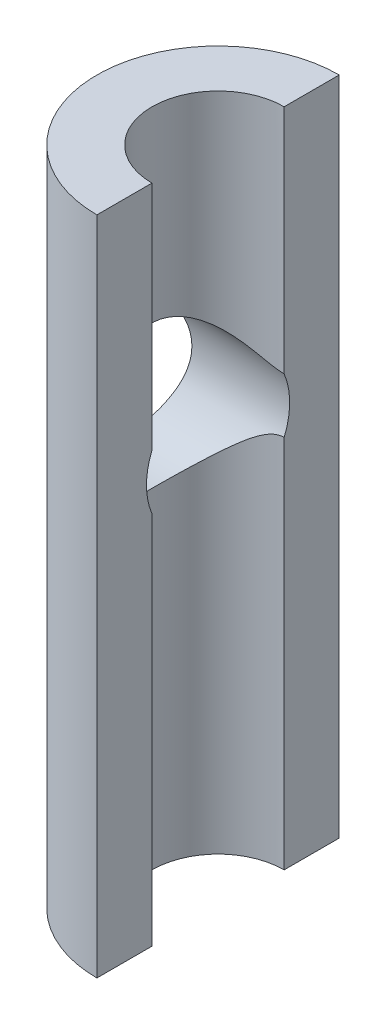
from build123d import *

# Parameters (mm, degrees)
BOSS_EXTRUDE1_DEPTH     = 30
CUT_EXTRUDE1_DEPTH      = 31.991934435
CUT_EXTRUDE1_DEPTH_BACK = 31.991934435
SKETCH2_R               = 3.25


with BuildPart() as part:
    # Sketch1 → Boss-Extrude1 (new body)
    with BuildSketch(Plane(origin=(0, 0, 0), x_dir=(1, 0, 0), z_dir=(0, 1, 0))):
        with BuildLine():
            Line((0, 5.5), (0, 3))
            ThreePointArc((0, 3), (-3, 0), (0, -3))
            Line((0, -3), (0, -5.5))
            ThreePointArc((0, -5.5), (-5.5, 0), (0, 5.5))
        make_face()
    extrude(amount=BOSS_EXTRUDE1_DEPTH)

    # Sketch2 → Cut-Extrude1 (cut, two sides: drawn at the far end of the back side and taken through both)
    with BuildSketch(Plane(origin=(0, 0, 0), x_dir=(0, 0, -1), z_dir=(1, 0, 0)).offset(-CUT_EXTRUDE1_DEPTH_BACK)):
        with Locations(Location((0, 18.25, 0), (0, 0, 337.380135052))):
            Circle(SKETCH2_R)
    extrude(amount=CUT_EXTRUDE1_DEPTH + CUT_EXTRUDE1_DEPTH_BACK, mode=Mode.SUBTRACT)


solid = part.part
